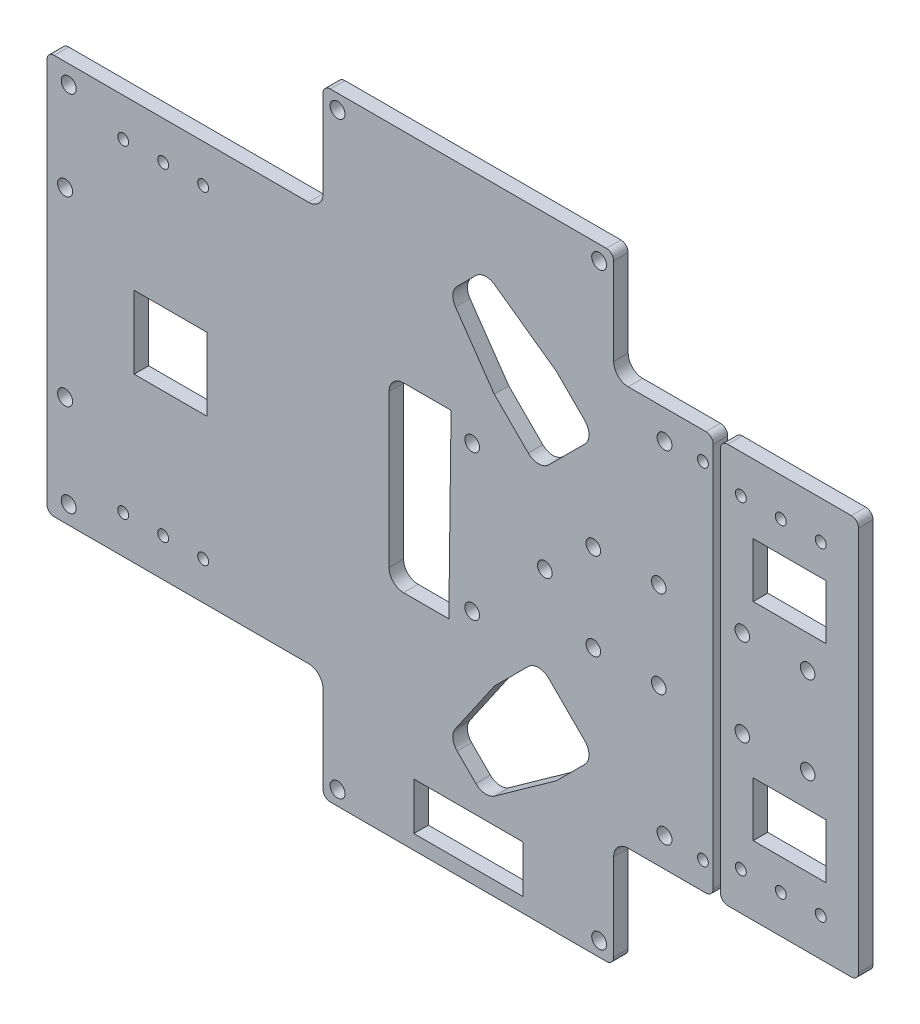
from build123d import *

# Parameters (mm, degrees)
SKETCH_1_W          = 20
SKETCH_1_H          = 20
SKETCH_1_W_2        = 30
SKETCH_1_H_2        = 13
EXTRUDE_1_DEPTH     = 4
SKETCH_1_H_3        = 15
EXTRUDE_1_2_DEPTH   = 4
EXTRUDE_3_DEPTH     = 4
SKETCH_3_R          = 2.025
CUT_EXTRUDE_1_DEPTH = 4
SKETCH_4_R          = 4.534393281
SKETCH_4_R_2        = 5.181070976
SKETCH_4_R_3        = 2.875367439
EXTRUDE_4_DEPTH     = 4


with BuildPart() as part:
    # 草图1 → 凸台-拉伸1 (new body)
    with BuildSketch(Plane.XY):
        with BuildLine():
            Line((27.846206897, 25.145291856), (-48.153793103, 25.145291856))
            ThreePointArc((-48.153793103, 25.145291856), (-49.568006666, 24.559505418), (-50.153793103, 23.145291856))
            Line((-50.153793103, 23.145291856), (-50.153793103, -0.854708144))
            ThreePointArc((-50.153793103, -0.854708144), (-51.325365979, -3.683135269), (-54.153793104, -4.854708144))
            Line((-54.153793104, -4.854708144), (-124.153793104, -4.854708144))
            ThreePointArc((-124.153793104, -4.854708144), (-125.568006666, -5.440494581), (-126.153793104, -6.854708144))
            Line((-126.153793104, -6.854708144), (-126.153793104, -112.854708144))
            ThreePointArc((-126.153793104, -112.854708144), (-125.568006666, -114.268921706), (-124.153793104, -114.854708144))
            Line((-124.153793104, -114.854708144), (-54.153793104, -114.854708144))
            ThreePointArc((-54.153793104, -114.854708144), (-51.325365979, -116.026281019), (-50.153793104, -118.854708144))
            Line((-50.153793104, -118.854708144), (-50.153793104, -142.854708144))
            ThreePointArc((-50.153793104, -142.854708144), (-49.568006666, -144.268921706), (-48.153793104, -144.854708144))
            Line((-48.153793104, -144.854708144), (27.846206896, -144.854708144))
            ThreePointArc((27.846206896, -144.854708144), (29.260420459, -144.268921706), (29.846206896, -142.854708144))
            Line((29.846206896, -142.854708144), (29.846206896, -118.854708144))
            ThreePointArc((29.846206896, -118.854708144), (31.017779772, -116.026281019), (33.846206896, -114.854708144))
            Line((33.846206896, -114.854708144), (55.246206896, -114.854708144))
            ThreePointArc((55.246206896, -114.854708144), (56.660420459, -114.268921707), (57.246206896, -112.854708144))
            Line((57.246206896, -112.854708144), (57.246206896, -6.854708144))
            ThreePointArc((57.246206896, -6.854708144), (56.660420459, -5.440494582), (55.246206896, -4.854708144))
            Line((55.246206896, -4.854708144), (33.846206896, -4.854708144))
            ThreePointArc((33.846206896, -4.854708144), (31.017779772, -3.683135269), (29.846206897, -0.854708144))
            Line((29.846206897, -0.854708144), (29.846206897, 23.145291856))
            ThreePointArc((29.846206897, 23.145291856), (29.260420459, 24.559505418), (27.846206897, 25.145291856))
        make_face()
        with BuildLine():
            Line((-3.011285112, -94.638607024), (-13.710575859, -110.144370171))
            ThreePointArc((-13.710575859, -110.144370171), (-14.401844612, -112.778422163), (-13.246713705, -115.244543606))
            Line((-13.246713705, -115.244543606), (-8.100082873, -120.391174438))
            ThreePointArc((-8.100082873, -120.391174438), (-5.601577875, -121.549118017), (-2.946702974, -120.817681198))
            Line((-2.946702974, -120.817681198), (14.094944235, -108.64507605))
            Line((14.094944235, -108.64507605), (21.873118828, -100.866901456))
            ThreePointArc((21.873118828, -100.866901456), (23.044691704, -98.038474332), (21.873118828, -95.210047207))
            Line((21.873118828, -95.210047207), (11.973623892, -85.31055227))
            ThreePointArc((11.973623892, -85.31055227), (10.675930497, -84.443461265), (9.145196767, -84.138979395))
            ThreePointArc((9.145196767, -84.138979395), (7.614463038, -84.443461265), (6.316769642, -85.31055227))
            Line((6.316769642, -85.31055227), (-3.011285112, -94.638607024))
        make_face(mode=Mode.SUBTRACT)
        with BuildLine():
            Line((-8.10008287, 0.681758144), (-13.246713702, -4.464872688))
            ThreePointArc((-13.246713702, -4.464872688), (-14.401844609, -6.930994131), (-13.710575857, -9.565046123))
            Line((-13.710575857, -9.565046123), (-3.01128511, -25.07080927))
            Line((-3.01128511, -25.07080927), (6.316769644, -34.398864024))
            ThreePointArc((6.316769644, -34.398864024), (9.145196769, -35.5704369), (11.973623894, -34.398864025))
            Line((11.973623894, -34.398864025), (21.87311883, -24.499369088))
            ThreePointArc((21.87311883, -24.499369088), (23.044691706, -21.670941963), (21.873118831, -18.842514839))
            Line((21.873118831, -18.842514839), (14.094944238, -11.064340246))
            Line((14.094944238, -11.064340246), (-2.946702971, 1.108264904))
            ThreePointArc((-2.946702971, 1.108264904), (-4.050946021, 1.662513053), (-5.271655745, 1.853331019))
            ThreePointArc((-5.271655745, 1.853331019), (-6.802389475, 1.548849149), (-8.10008287, 0.681758144))
        make_face(mode=Mode.SUBTRACT)
        with BuildLine():
            Line((-14.948033148, -34.854708147), (-27.983793104, -34.854708147))
            ThreePointArc((-27.983793104, -34.854708147), (-30.812220229, -36.026281022), (-31.983793105, -38.854708146))
            Line((-31.983793105, -38.854708146), (-31.983793105, -80.854708146))
            ThreePointArc((-31.983793105, -80.854708146), (-30.812220229, -83.683135271), (-27.983793105, -84.854708147))
            Line((-27.983793105, -84.854708147), (-15.206986384, -84.854708147))
            ThreePointArc((-15.206986384, -84.854708147), (-8.393134945, -82.173958694), (-5.23252921, -75.568993861))
            ThreePointArc((-5.23252921, -75.568993861), (-3.968286916, -72.927007928), (-1.24274634, -71.854708147))
            Line((-1.24274634, -71.854708147), (-0.983793104, -71.854708147))
            ThreePointArc((-0.983793104, -71.854708147), (1.84463402, -70.683135272), (3.016206896, -67.854708147))
            Line((3.016206896, -67.854708147), (3.016206896, -51.854708147))
            ThreePointArc((3.016206896, -51.854708147), (1.844634021, -49.026281022), (-0.983793104, -47.854708147))
            ThreePointArc((-0.983793104, -47.854708147), (-3.70933368, -46.782408366), (-4.973575974, -44.140422433))
            ThreePointArc((-4.973575974, -44.140422433), (-8.13418171, -37.5354576), (-14.948033148, -34.854708147))
        make_face(mode=Mode.SUBTRACT)
        with Locations((-92.153793105, -59.854708144)):
            Rectangle(SKETCH_1_W, SKETCH_1_H, mode=Mode.SUBTRACT)
        with Locations((-10.153793108, -134.354708147)):
            Rectangle(SKETCH_1_W_2, SKETCH_1_H_2, mode=Mode.SUBTRACT)
        with BuildLine():
            ThreePointArc((-94.153793106, -102.854708145), (-95.653793106, -104.354708145), (-94.153793107, -105.854708145))
            ThreePointArc((-94.153793107, -105.854708145), (-92.653793106, -104.354708145), (-94.153793106, -102.854708145))
        make_face(mode=Mode.SUBTRACT)
        with BuildLine():
            ThreePointArc((-46.153793103, 23.195291854), (-48.203793103, 21.145291854), (-46.153793103, 19.095291854))
            ThreePointArc((-46.153793103, 19.095291854), (-44.103793103, 21.145291854), (-46.153793103, 23.195291854))
        make_face(mode=Mode.SUBTRACT)
        with BuildLine():
            ThreePointArc((25.846206897, 23.195291852), (23.796206897, 21.145291852), (25.846206897, 19.095291852))
            ThreePointArc((25.846206897, 19.095291852), (27.896206897, 21.145291852), (25.846206897, 23.195291852))
        make_face(mode=Mode.SUBTRACT)
        with BuildLine():
            ThreePointArc((43.846206896, -10.804708149), (41.796206896, -12.854708149), (43.846206896, -14.904708149))
            ThreePointArc((43.846206896, -14.904708149), (45.896206896, -12.854708149), (43.846206896, -10.804708149))
        make_face(mode=Mode.SUBTRACT)
        with BuildLine():
            ThreePointArc((-15.653793106, -89.804708147), (-17.703793106, -91.854708147), (-15.653793106, -93.904708147))
            ThreePointArc((-15.653793106, -93.904708147), (-13.603793106, -91.854708147), (-15.653793106, -89.804708147))
        make_face(mode=Mode.SUBTRACT)
        with BuildLine():
            ThreePointArc((43.846206894, -104.804708149), (41.796206893, -106.854708149), (43.846206893, -108.904708149))
            ThreePointArc((43.846206893, -108.904708149), (45.896206893, -106.854708149), (43.846206894, -104.804708149))
        make_face(mode=Mode.SUBTRACT)
        with BuildLine():
            ThreePointArc((25.846206893, -138.804708148), (23.796206892, -140.854708148), (25.846206892, -142.904708148))
            ThreePointArc((25.846206892, -142.904708148), (27.896206892, -140.854708148), (25.846206893, -138.804708148))
        make_face(mode=Mode.SUBTRACT)
        with BuildLine():
            ThreePointArc((-46.153793107, -138.804708146), (-48.203793108, -140.854708146), (-46.153793108, -142.904708146))
            ThreePointArc((-46.153793108, -142.904708146), (-44.103793108, -140.854708146), (-46.153793107, -138.804708146))
        make_face(mode=Mode.SUBTRACT)
        with BuildLine():
            ThreePointArc((54.405349437, -13.854708144), (55.905349437, -12.354708144), (54.405349437, -10.854708144))
            ThreePointArc((54.405349437, -10.854708144), (52.905349437, -12.354708144), (54.405349437, -13.854708144))
        make_face(mode=Mode.SUBTRACT)
        with BuildLine():
            ThreePointArc((54.405349437, -108.854708144), (55.905349437, -107.354708144), (54.405349437, -105.854708144))
            ThreePointArc((54.405349437, -105.854708144), (52.905349437, -107.354708144), (54.405349437, -108.854708144))
        make_face(mode=Mode.SUBTRACT)
        with BuildLine():
            ThreePointArc((24.246206894, -73.854708148), (26.246206894, -71.854708148), (24.246206895, -69.854708148))
            ThreePointArc((24.246206895, -69.854708148), (22.246206894, -71.854708148), (24.246206894, -73.854708148))
        make_face(mode=Mode.SUBTRACT)
        with BuildLine():
            ThreePointArc((42.246206895, -49.854708149), (44.246206895, -47.854708149), (42.246206895, -45.854708149))
            ThreePointArc((42.246206895, -45.854708149), (40.246206895, -47.854708149), (42.246206895, -49.854708149))
        make_face(mode=Mode.SUBTRACT)
        with BuildLine():
            ThreePointArc((-105.153793104, -13.854708144), (-106.653793104, -15.354708144), (-105.153793104, -16.854708144))
            ThreePointArc((-105.153793104, -16.854708144), (-103.653793104, -15.354708144), (-105.153793104, -13.854708144))
        make_face(mode=Mode.SUBTRACT)
        with BuildLine():
            ThreePointArc((-94.153793104, -13.854708145), (-95.653793104, -15.354708145), (-94.153793104, -16.854708145))
            ThreePointArc((-94.153793104, -16.854708145), (-92.653793104, -15.354708145), (-94.153793104, -13.854708145))
        make_face(mode=Mode.SUBTRACT)
        with BuildLine():
            ThreePointArc((-83.153793104, -13.854708145), (-84.653793104, -15.354708145), (-83.153793104, -16.854708145))
            ThreePointArc((-83.153793104, -16.854708145), (-81.653793104, -15.354708145), (-83.153793104, -13.854708145))
        make_face(mode=Mode.SUBTRACT)
        with BuildLine():
            ThreePointArc((-83.153793106, -102.854708145), (-84.653793106, -104.354708145), (-83.153793107, -105.854708145))
            ThreePointArc((-83.153793107, -105.854708145), (-81.653793106, -104.354708145), (-83.153793106, -102.854708145))
        make_face(mode=Mode.SUBTRACT)
        with BuildLine():
            ThreePointArc((-15.653793104, -25.804708147), (-17.703793104, -27.854708147), (-15.653793104, -29.904708147))
            ThreePointArc((-15.653793104, -29.904708147), (-13.603793104, -27.854708147), (-15.653793104, -25.804708147))
        make_face(mode=Mode.SUBTRACT)
        with BuildLine():
            ThreePointArc((42.246206895, -69.854708149), (40.246206894, -71.854708149), (42.246206894, -73.854708149))
            ThreePointArc((42.246206894, -73.854708149), (44.246206894, -71.854708149), (42.246206895, -69.854708149))
        make_face(mode=Mode.SUBTRACT)
        with BuildLine():
            ThreePointArc((-120.153793107, -107.794708144), (-122.213793107, -109.854708144), (-120.153793107, -111.914708144))
            ThreePointArc((-120.153793107, -111.914708144), (-118.093793107, -109.854708144), (-120.153793107, -107.794708144))
        make_face(mode=Mode.SUBTRACT)
        with BuildLine():
            ThreePointArc((-121.153793106, -82.794708144), (-123.213793106, -84.854708144), (-121.153793106, -86.914708144))
            ThreePointArc((-121.153793106, -86.914708144), (-119.093793106, -84.854708144), (-121.153793106, -82.794708144))
        make_face(mode=Mode.SUBTRACT)
        with BuildLine():
            ThreePointArc((-45.653793105, -57.804708146), (-47.703793105, -59.854708146), (-45.653793105, -61.904708146))
            ThreePointArc((-45.653793105, -61.904708146), (-43.603793105, -59.854708146), (-45.653793105, -57.804708146))
        make_face(mode=Mode.SUBTRACT)
        with BuildLine():
            ThreePointArc((24.246206895, -45.854708148), (22.246206895, -47.854708148), (24.246206895, -49.854708148))
            ThreePointArc((24.246206895, -49.854708148), (26.246206895, -47.854708148), (24.246206895, -45.854708148))
        make_face(mode=Mode.SUBTRACT)
        with BuildLine():
            ThreePointArc((-121.153793104, -32.794708144), (-123.213793104, -34.854708144), (-121.153793105, -36.914708144))
            ThreePointArc((-121.153793105, -36.914708144), (-119.093793104, -34.854708144), (-121.153793104, -32.794708144))
        make_face(mode=Mode.SUBTRACT)
        with BuildLine():
            ThreePointArc((-120.153793104, -7.794708144), (-122.213793104, -9.854708144), (-120.153793104, -11.914708144))
            ThreePointArc((-120.153793104, -11.914708144), (-118.093793104, -9.854708144), (-120.153793104, -7.794708144))
        make_face(mode=Mode.SUBTRACT)
        with BuildLine():
            ThreePointArc((-105.153793106, -102.854708144), (-106.653793106, -104.354708144), (-105.153793107, -105.854708144))
            ThreePointArc((-105.153793107, -105.854708144), (-103.653793106, -104.354708144), (-105.153793106, -102.854708144))
        make_face(mode=Mode.SUBTRACT)
    extrude(amount=-EXTRUDE_1_DEPTH)

    # 草图2 → 凸台-拉伸3 (add)
    with BuildSketch(Plane.XY):
        Polygon((-14.897582131, -33.474225313), (-15.549164529, -86.191397736), (5.166097721, -81.326873066), (9.386465613, -59.854708146), (9.386465613, -46.956741514), (-9.583407358, -32.400556512), align=None)
    extrude(amount=-EXTRUDE_3_DEPTH)

    # 草图3 → 切除-拉伸1 (cut)
    with BuildSketch(Plane.XY):
        with Locations((-9.097546349, -39.830915874)):
            Circle(SKETCH_3_R)
        with Locations((-9.097546099, -79.830915874)):
            Circle(SKETCH_3_R)
        with Locations((10.902453776, -59.830915749)):
            Circle(SKETCH_3_R)
    extrude(amount=-CUT_EXTRUDE_1_DEPTH, mode=Mode.SUBTRACT)

    # 草图4 → 凸台-拉伸4 (add)
    with BuildSketch(Plane.XY):
        with Locations((-15.653793104, -27.854708147)):
            Circle(SKETCH_4_R)
        with Locations((-45.653793105, -59.854708146)):
            Circle(SKETCH_4_R_2)
        with Locations((-15.653793106, -91.854708147)):
            Circle(SKETCH_4_R_3)
    extrude(amount=-EXTRUDE_4_DEPTH)


with BuildPart() as body_2:
    # 草图1 → Extrude 1 2 (new body)
    with BuildSketch(Plane.XY):
        with BuildLine():
            Line((95.246206896, -4.854708149), (61.246206896, -4.854708149))
            ThreePointArc((61.246206896, -4.854708149), (59.831993334, -5.440494587), (59.246206896, -6.854708149))
            Line((59.246206896, -6.854708149), (59.246206896, -112.854708149))
            ThreePointArc((59.246206896, -112.854708149), (59.831993334, -114.268921711), (61.246206896, -114.854708149))
            Line((61.246206896, -114.854708149), (95.246206896, -114.854708149))
            ThreePointArc((95.246206896, -114.854708149), (96.660420459, -114.268921712), (97.246206896, -112.854708149))
            Line((97.246206896, -112.854708149), (97.246206896, -6.854708149))
            ThreePointArc((97.246206896, -6.854708149), (96.660420459, -5.440494587), (95.246206896, -4.854708149))
        make_face()
        with Locations((78.246206894, -88.354708149)):
            Rectangle(SKETCH_1_W, SKETCH_1_H_3, mode=Mode.SUBTRACT)
        with Locations((78.246206895, -31.354708149)):
            Rectangle(SKETCH_1_W, SKETCH_1_H_3, mode=Mode.SUBTRACT)
        with BuildLine():
            ThreePointArc((86.846206896, -13.85470815), (85.346206896, -15.35470815), (86.846206896, -16.85470815))
            ThreePointArc((86.846206896, -16.85470815), (88.346206896, -15.35470815), (86.846206896, -13.85470815))
        make_face(mode=Mode.SUBTRACT)
        with BuildLine():
            ThreePointArc((65.246206895, -45.854708149), (63.246206895, -47.854708149), (65.246206895, -49.854708149))
            ThreePointArc((65.246206895, -49.854708149), (67.246206895, -47.854708149), (65.246206895, -45.854708149))
        make_face(mode=Mode.SUBTRACT)
        with BuildLine():
            ThreePointArc((64.846206896, -13.854708149), (63.346206896, -15.354708149), (64.846206896, -16.854708149))
            ThreePointArc((64.846206896, -16.854708149), (66.346206896, -15.354708149), (64.846206896, -13.854708149))
        make_face(mode=Mode.SUBTRACT)
        with BuildLine():
            ThreePointArc((75.846206896, -13.85470815), (74.346206896, -15.354708149), (75.846206896, -16.85470815))
            ThreePointArc((75.846206896, -16.85470815), (77.346206896, -15.35470815), (75.846206896, -13.85470815))
        make_face(mode=Mode.SUBTRACT)
        with BuildLine():
            ThreePointArc((86.846206894, -102.85470815), (85.346206894, -104.35470815), (86.846206893, -105.85470815))
            ThreePointArc((86.846206893, -105.85470815), (88.346206894, -104.35470815), (86.846206894, -102.85470815))
        make_face(mode=Mode.SUBTRACT)
        with BuildLine():
            ThreePointArc((75.846206894, -102.85470815), (74.346206894, -104.354708149), (75.846206893, -105.85470815))
            ThreePointArc((75.846206893, -105.85470815), (77.346206894, -104.35470815), (75.846206894, -102.85470815))
        make_face(mode=Mode.SUBTRACT)
        with BuildLine():
            ThreePointArc((64.846206894, -102.854708149), (63.346206894, -104.354708149), (64.846206893, -105.854708149))
            ThreePointArc((64.846206893, -105.854708149), (66.346206894, -104.354708149), (64.846206894, -102.854708149))
        make_face(mode=Mode.SUBTRACT)
        with BuildLine():
            ThreePointArc((83.246206895, -49.85470815), (85.246206895, -47.85470815), (83.246206895, -45.85470815))
            ThreePointArc((83.246206895, -45.85470815), (81.246206895, -47.85470815), (83.246206895, -49.85470815))
        make_face(mode=Mode.SUBTRACT)
        with BuildLine():
            ThreePointArc((65.246206894, -73.854708149), (67.246206894, -71.854708149), (65.246206895, -69.854708149))
            ThreePointArc((65.246206895, -69.854708149), (63.246206894, -71.854708149), (65.246206894, -73.854708149))
        make_face(mode=Mode.SUBTRACT)
        with BuildLine():
            ThreePointArc((83.246206895, -69.85470815), (81.246206894, -71.85470815), (83.246206894, -73.85470815))
            ThreePointArc((83.246206894, -73.85470815), (85.246206894, -71.85470815), (83.246206895, -69.85470815))
        make_face(mode=Mode.SUBTRACT)
    extrude(amount=-EXTRUDE_1_2_DEPTH)


solid = Compound([part.part, body_2.part])
